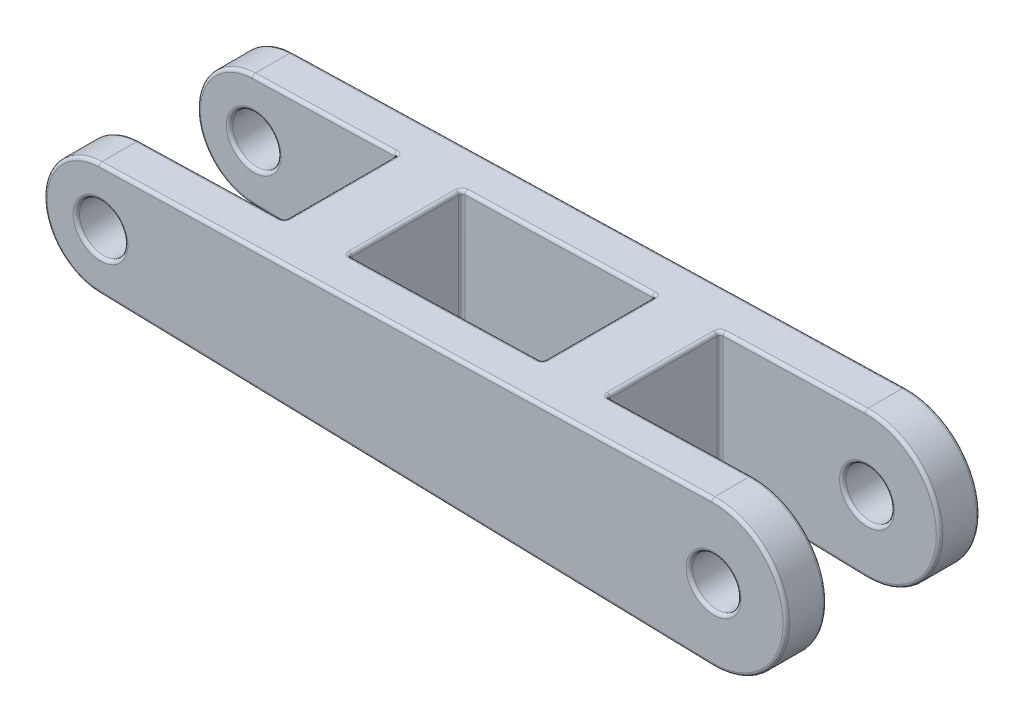
from build123d import *

# Parameters (mm, degrees)
SKETCH1_R               = 0.75
BOSS_EXTRUDE1_DEPTH     = 3
CUT_EXTRUDE1_DEPTH      = 22.086132884
CUT_EXTRUDE1_DEPTH_BACK = 22.086132884
SKETCH2_W               = 8
SKETCH2_H               = 3.5
SKETCH2_W_2             = 6
FILLET1_R               = 0.1


with BuildPart() as part:
    # Sketch1 → Boss-Extrude1 (new, symmetric)
    with BuildSketch(Plane.XY):
        with BuildLine():
            Line((-19.046052632, 1.749393939), (-0.059210526, 2.249220779))
            ThreePointArc((-0.059210526, 2.249220779), (2.25, 0), (-0.059210526, -2.249220779))
            Line((-0.059210526, -2.249220779), (-19.046052632, -1.749393939))
            ThreePointArc((-19.046052632, -1.749393939), (-20.75, 0), (-19.046052632, 1.749393939))
        make_face()
        with Locations((-19, 0)):
            Circle(SKETCH1_R, mode=Mode.SUBTRACT)
        Circle(SKETCH1_R, mode=Mode.SUBTRACT)
    extrude(amount=BOSS_EXTRUDE1_DEPTH, both=True)

    # Sketch2 → Cut-Extrude1 (cut, two sides: drawn at the far end of the back side and taken through both)
    with BuildSketch(Plane(origin=(0, 0, 0), x_dir=(1, 0, 0), z_dir=(0, 1, 0)).offset(-CUT_EXTRUDE1_DEPTH_BACK)):
        with Locations((-18.552631579, 0)):
            Rectangle(SKETCH2_W, SKETCH2_H)
        with Locations((-9.552631579, 0)):
            Rectangle(SKETCH2_W_2, SKETCH2_H)
        with Locations((-0.552631579, 0)):
            Rectangle(SKETCH2_W, SKETCH2_H)
    extrude(amount=CUT_EXTRUDE1_DEPTH + CUT_EXTRUDE1_DEPTH_BACK, mode=Mode.SUBTRACT)

    # Fillet1
    fillet1_edges = [part.edges().sort_by_distance(p)[0] for p in [
        (-19.75, 0, -3),
        (-19.75, 0, 3),
        (2.25, 0, 3),
        (-0.75, 0, -3),
        (-0.75, 0, 3),
        (-9.552631579, 1.999307359, 3),
        (-4.552631579, 2.130931891, 0),
        (-9.552631579, 1.999307359, 1.75),
        (-6.552631579, 2.078282078, 0),
        (-9.552631579, 1.999307359, -1.75),
        (-12.552631579, 1.92033264, 0),
        (-14.552631579, 1.867682828, 0),
        (-14.552631579, -1.867682828, 0),
        (-14.552631579, 0, -1.75),
        (-16.799342105, -1.808538384, -1.75),
        (-20.75, 0, -1.75),
        (-16.799342105, 1.808538384, -1.75),
        (-19.75, 0, -1.75),
        (-20.75, 0, 1.75),
        (-16.799342105, -1.808538384, 1.75),
        (-14.552631579, 0, 1.75),
        (-16.799342105, 1.808538384, 1.75),
        (-19.75, 0, 1.75),
        (-20.75, 0, 3),
        (-9.552631579, 1.999307359, -3),
        (-12.552631579, -1.92033264, 0),
        (-12.552631579, 0, 1.75),
        (-9.552631579, -1.999307359, -1.75),
        (-12.552631579, 0, -1.75),
        (-6.552631579, -2.078282078, 0),
        (-6.552631579, 0, -1.75),
        (-9.552631579, -1.999307359, 1.75),
        (2.25, 0, -3),
        (-6.552631579, 0, 1.75),
        (-9.552631579, -1.999307359, -3),
        (-20.75, 0, -3),
        (-4.552631579, -2.130931891, 0),
        (-4.552631579, 0, 1.75),
        (2.25, 0, -1.75),
        (-2.305921053, -2.190076335, -1.75),
        (-4.552631579, 0, -1.75),
        (-2.305921053, 2.190076335, -1.75),
        (-0.75, 0, -1.75),
        (-2.305921053, -2.190076335, 1.75),
        (2.25, 0, 1.75),
        (-2.305921053, 2.190076335, 1.75),
        (-0.75, 0, 1.75),
        (-9.552631579, -1.999307359, 3),
    ]]
    fillet(fillet1_edges, radius=FILLET1_R)


solid = part.part
